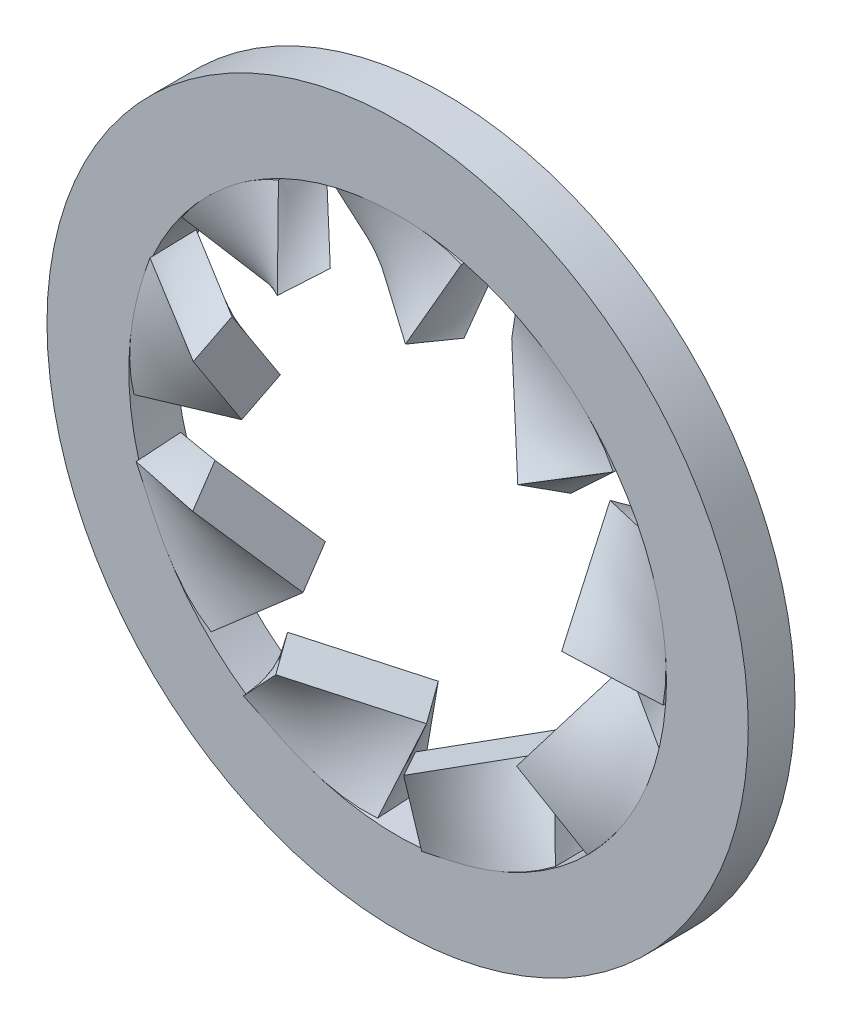
from build123d import *

# Parameters (mm, degrees)
CIRPATTERN1_COUNT       = 9
CUT_EXTRUDE1_DEPTH      = 4.375263996
CUT_EXTRUDE1_DEPTH_BACK = 4.375263996
SKETCH4_OUTSIDE_W       = 8.078
SKETCH4_OUTSIDE_H       = 8.007
SKETCH4_OUTSIDE_R       = 2.3
SKETCH5_R               = 3
SKETCH5_R_2             = 2.3
EXTRUDE1_DEPTH          = 0.2


with BuildPart() as part:
    # Sketch2 → Loft1 section 0
    with BuildSketch(Plane(origin=(0, 2.3, 0), x_dir=(-1, 0, 0), z_dir=(0, 1, 0))):
        with BuildLine():
            Line((-0.6, 0.2), (0.6, 0.2))
            Line((0.6, 0.2), (0.6, -0.2))
            Line((0.6, -0.2), (-0.6, -0.2))
            Line((-0.6, -0.2), (-0.6, 0.2))
        make_face()
    # Sketch3 → Loft1 section 1
    with BuildSketch(Plane(origin=(0, 1.6, 0), x_dir=(-1, 0, 0), z_dir=(0, 1, 0))):
        with BuildLine():
            Line((-0.289949223, 0.422764057), (-0.49643674, 0.127869321))
            Line((-0.49643674, 0.127869321), (0.289949223, -0.422764057))
            Line((0.289949223, -0.422764057), (0.49643674, -0.127869321))
            Line((0.49643674, -0.127869321), (-0.289949223, 0.422764057))
        make_face()
    loft()


with BuildPart() as cirpattern1_1:
    # CirPattern1: pattern copy
    add(part.part.rotate(Axis((0, 0, -0.531651249), (0, 0, 1)), 1 * 360 / CIRPATTERN1_COUNT))


with BuildPart() as cirpattern1_2:
    # CirPattern1: pattern copy
    add(part.part.rotate(Axis((0, 0, -0.531651249), (0, 0, 1)), 2 * 360 / CIRPATTERN1_COUNT))


with BuildPart() as cirpattern1_3:
    # CirPattern1: pattern copy
    add(part.part.rotate(Axis((0, 0, -0.531651249), (0, 0, 1)), 3 * 360 / CIRPATTERN1_COUNT))


with BuildPart() as cirpattern1_4:
    # CirPattern1: pattern copy
    add(part.part.rotate(Axis((0, 0, -0.531651249), (0, 0, 1)), 4 * 360 / CIRPATTERN1_COUNT))


with BuildPart() as cirpattern1_5:
    # CirPattern1: pattern copy
    add(part.part.rotate(Axis((0, 0, -0.531651249), (0, 0, 1)), 5 * 360 / CIRPATTERN1_COUNT))


with BuildPart() as cirpattern1_6:
    # CirPattern1: pattern copy
    add(part.part.rotate(Axis((0, 0, -0.531651249), (0, 0, 1)), 6 * 360 / CIRPATTERN1_COUNT))


with BuildPart() as cirpattern1_7:
    # CirPattern1: pattern copy
    add(part.part.rotate(Axis((0, 0, -0.531651249), (0, 0, 1)), 7 * 360 / CIRPATTERN1_COUNT))


with BuildPart() as cirpattern1_8:
    # CirPattern1: pattern copy
    add(part.part.rotate(Axis((0, 0, -0.531651249), (0, 0, 1)), 8 * 360 / CIRPATTERN1_COUNT))


with BuildPart() as cut_extrude1_tool:
    # Sketch4 outside → Cut-Extrude1 (new, two sides: drawn at the far end of the back side and taken through both)
    with BuildSketch(Plane.XY.offset(-CUT_EXTRUDE1_DEPTH_BACK)):
        with Locations((0, -0.0335)):
            Rectangle(SKETCH4_OUTSIDE_W, SKETCH4_OUTSIDE_H)
        Circle(SKETCH4_OUTSIDE_R, mode=Mode.SUBTRACT)
    extrude(amount=CUT_EXTRUDE1_DEPTH + CUT_EXTRUDE1_DEPTH_BACK)


with BuildPart() as part_1:
    add(part.part)

    # Cut-Extrude1: cut by cut_extrude1_tool
    add(cut_extrude1_tool.part, mode=Mode.SUBTRACT)



with BuildPart() as cirpattern1_1_1:
    add(cirpattern1_1.part)

    # Cut-Extrude1: cut by cut_extrude1_tool
    add(cut_extrude1_tool.part, mode=Mode.SUBTRACT)


with BuildPart() as cirpattern1_2_1:
    add(cirpattern1_2.part)

    # Cut-Extrude1: cut by cut_extrude1_tool
    add(cut_extrude1_tool.part, mode=Mode.SUBTRACT)


with BuildPart() as cirpattern1_3_1:
    add(cirpattern1_3.part)

    # Cut-Extrude1: cut by cut_extrude1_tool
    add(cut_extrude1_tool.part, mode=Mode.SUBTRACT)


with BuildPart() as cirpattern1_4_1:
    add(cirpattern1_4.part)

    # Cut-Extrude1: cut by cut_extrude1_tool
    add(cut_extrude1_tool.part, mode=Mode.SUBTRACT)


with BuildPart() as cirpattern1_5_1:
    add(cirpattern1_5.part)

    # Cut-Extrude1: cut by cut_extrude1_tool
    add(cut_extrude1_tool.part, mode=Mode.SUBTRACT)


with BuildPart() as cirpattern1_6_1:
    add(cirpattern1_6.part)

    # Cut-Extrude1: cut by cut_extrude1_tool
    add(cut_extrude1_tool.part, mode=Mode.SUBTRACT)


with BuildPart() as cirpattern1_7_1:
    add(cirpattern1_7.part)

    # Cut-Extrude1: cut by cut_extrude1_tool
    add(cut_extrude1_tool.part, mode=Mode.SUBTRACT)


with BuildPart() as cirpattern1_8_1:
    add(cirpattern1_8.part)

    # Cut-Extrude1: cut by cut_extrude1_tool
    add(cut_extrude1_tool.part, mode=Mode.SUBTRACT)


with BuildPart() as part_2:
    add(part_1.part)

    add(cirpattern1_1_1.part)  # Extrude1 merges CirPattern1_1

    add(cirpattern1_2_1.part)  # Extrude1 merges CirPattern1_2

    add(cirpattern1_3_1.part)  # Extrude1 merges CirPattern1_3

    add(cirpattern1_4_1.part)  # Extrude1 merges CirPattern1_4

    add(cirpattern1_5_1.part)  # Extrude1 merges CirPattern1_5

    add(cirpattern1_6_1.part)  # Extrude1 merges CirPattern1_6

    add(cirpattern1_7_1.part)  # Extrude1 merges CirPattern1_7

    add(cirpattern1_8_1.part)  # Extrude1 merges CirPattern1_8
    # Sketch5 → Extrude1 (add, symmetric)
    with BuildSketch(Plane.XY):
        Circle(SKETCH5_R)
        Circle(SKETCH5_R_2, mode=Mode.SUBTRACT)
    extrude(amount=EXTRUDE1_DEPTH, both=True)


solid = part_2.part
